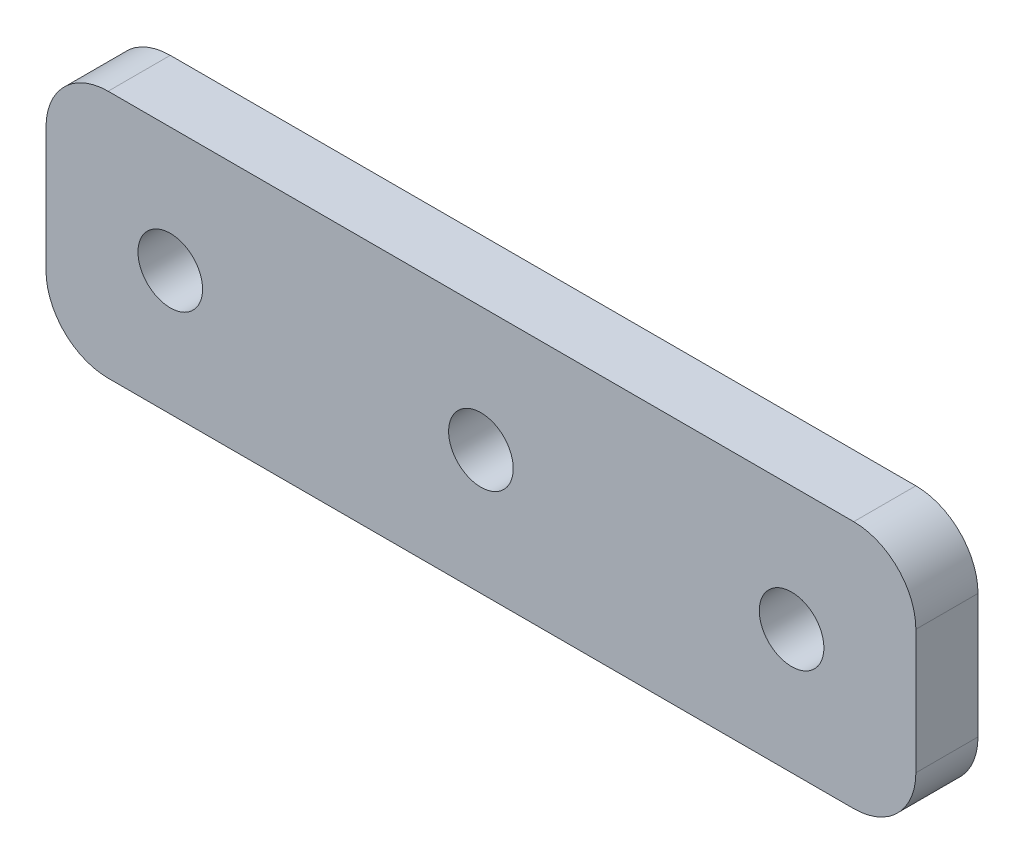
from build123d import *

# Parameters (mm, degrees)
SKETCH_2_W      = 70
SKETCH_2_H      = 20
SKETCH_2_R      = 2.6
EXTRUDE_1_DEPTH = 5
FILLET_1_R      = 5


with BuildPart() as part:
    # ｽｹｯﾁ2 → ﾎﾞｽ - 押し出し1 (new body)
    with BuildSketch(Plane.XY):
        with Locations((25, 0)):
            Rectangle(SKETCH_2_W, SKETCH_2_H)
        with Locations((25, 0)):
            Circle(SKETCH_2_R, mode=Mode.SUBTRACT)
        with Locations((50, 0)):
            Circle(SKETCH_2_R, mode=Mode.SUBTRACT)
        Circle(SKETCH_2_R, mode=Mode.SUBTRACT)
    extrude(amount=EXTRUDE_1_DEPTH)

    # ﾌｨﾚｯﾄ1
    fillet_1_edges = [part.edges().sort_by_distance(p)[0] for p in [
        (-10, 10, 2.5),
        (60, 10, 2.5),
        (60, -10, 2.5),
        (-10, -10, 2.5),
    ]]
    fillet(fillet_1_edges, radius=FILLET_1_R)


solid = part.part
